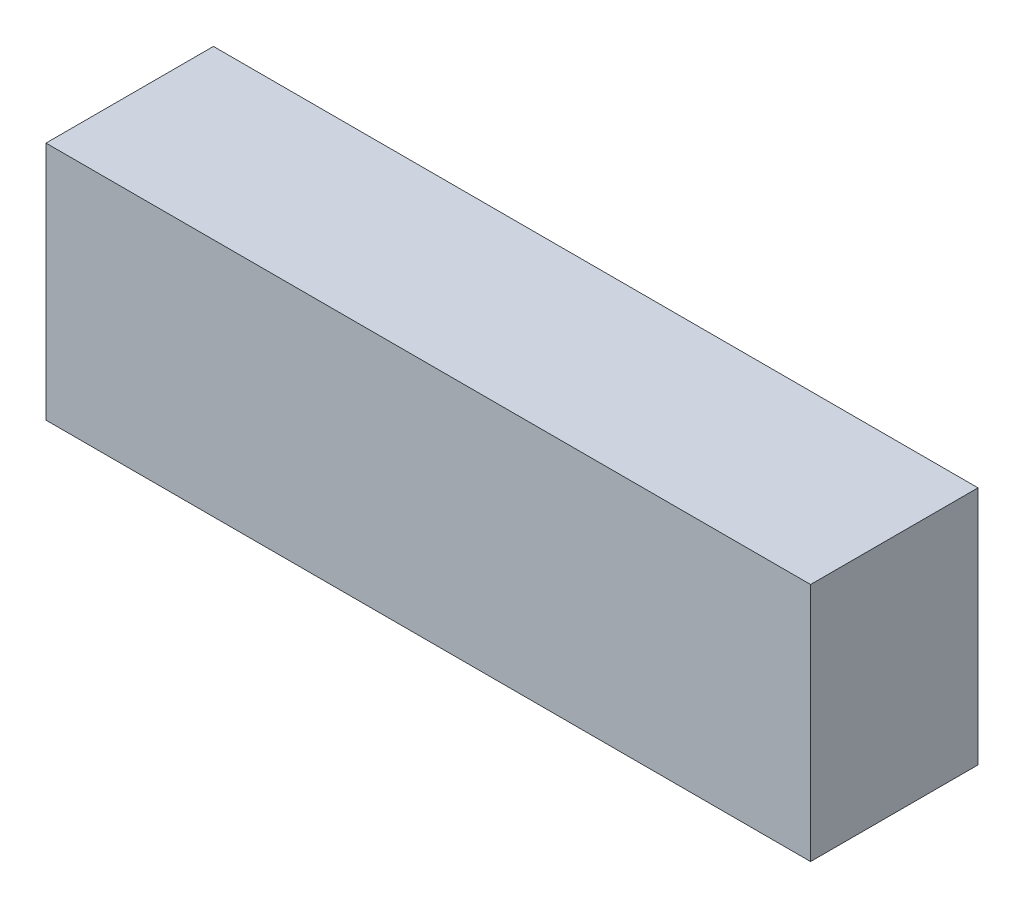
from build123d import *

# Parameters (mm, degrees)
ESQUISSE1_W        = 137
ESQUISSE1_H        = 43
BOSS_EXTRU_1_DEPTH = 30


with BuildPart() as part:
    # Esquisse1 → Boss.-Extru.1 (new body)
    with BuildSketch(Plane.XY):
        with Locations((68.5, 21.5)):
            Rectangle(ESQUISSE1_W, ESQUISSE1_H)
    extrude(amount=BOSS_EXTRU_1_DEPTH)


solid = part.part
